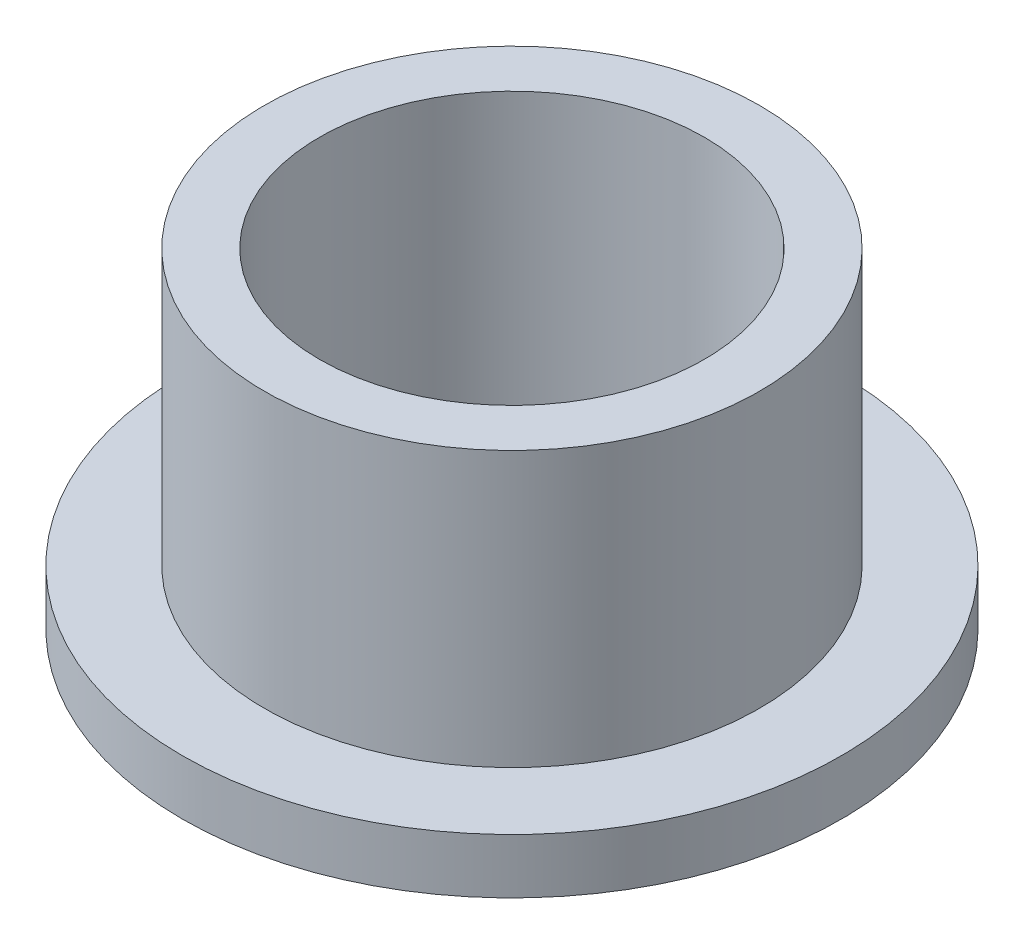
from build123d import *

# Parameters (mm, degrees)
SKETCH2_R           = 14.3129
SKETCH2_R_2         = 11.1252
BOSS_EXTRUDE1_DEPTH = 19.05
SKETCH3_R           = 19.05
SKETCH3_R_2         = 14.3129
BOSS_EXTRUDE2_DEPTH = 3.175


with BuildPart() as part:
    # Sketch2 → Boss-Extrude1 (new body)
    with BuildSketch(Plane(origin=(0, 0, 0), x_dir=(1, 0, 0), z_dir=(0, 1, 0))):
        with Locations(Location((0, 0, 0), (0, 0, 90))):
            Circle(SKETCH2_R)
        with Locations(Location((0, 0, 0), (0, 0, 90))):
            Circle(SKETCH2_R_2, mode=Mode.SUBTRACT)
    extrude(amount=BOSS_EXTRUDE1_DEPTH)

    # Sketch3 → Boss-Extrude2 (add)
    with BuildSketch(Plane(origin=(0, 0, 0), x_dir=(1, 0, 0), z_dir=(0, 1, 0))):
        with Locations(Location((0, 0, 0), (0, 0, 270))):
            Circle(SKETCH3_R)
        with Locations(Location((0, 0, 0), (0, 0, 90))):
            Circle(SKETCH3_R_2, mode=Mode.SUBTRACT)
    extrude(amount=BOSS_EXTRUDE2_DEPTH)


solid = part.part
